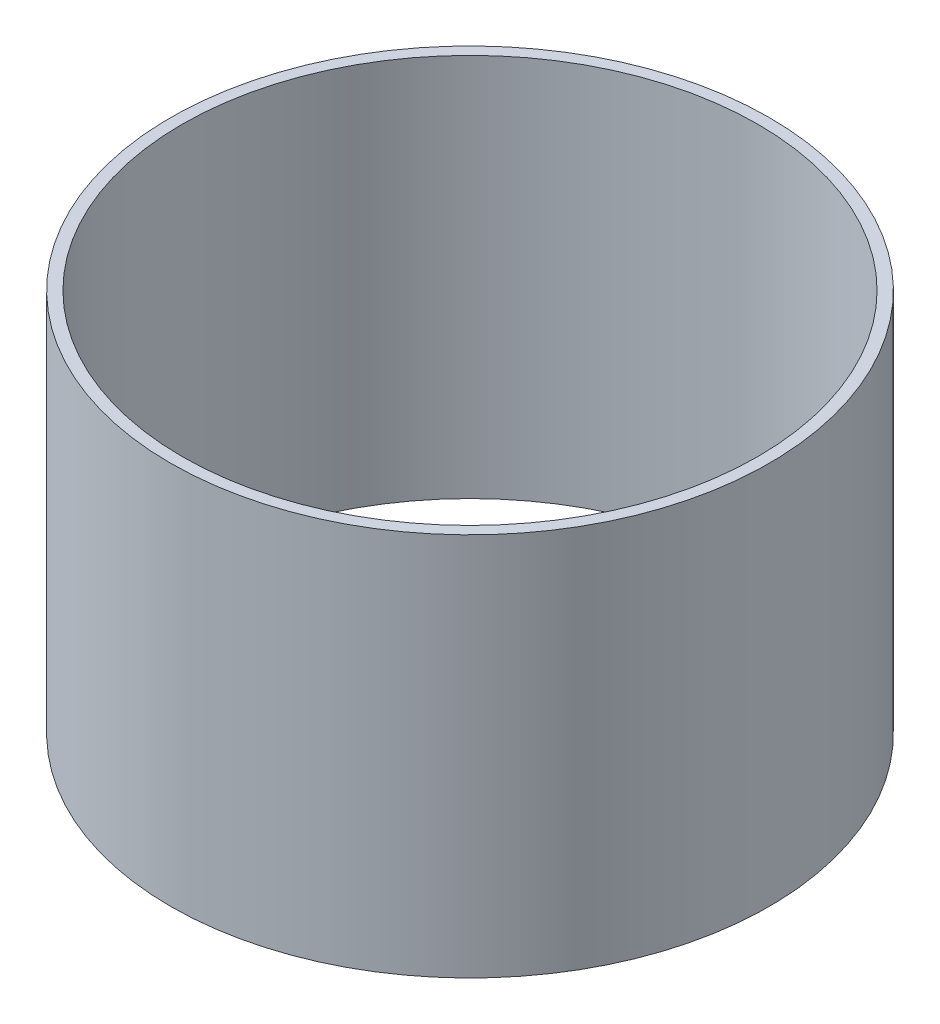
from build123d import *

# Parameters (mm, degrees)
SKETCH1_R           = 39.624
SKETCH1_R_2         = 38.1
BOSS_EXTRUDE1_DEPTH = 50.8


with BuildPart() as part:
    # Sketch1 → Boss-Extrude1 (new body)
    with BuildSketch(Plane(origin=(0, 0, 0), x_dir=(1, 0, 0), z_dir=(0, 1, 0))):
        with Locations(Location((0, 0, 0), (0, 0, 270))):
            Circle(SKETCH1_R)
        with Locations(Location((0, 0, 0), (0, 0, 270))):
            Circle(SKETCH1_R_2, mode=Mode.SUBTRACT)
    extrude(amount=BOSS_EXTRUDE1_DEPTH)


solid = part.part
